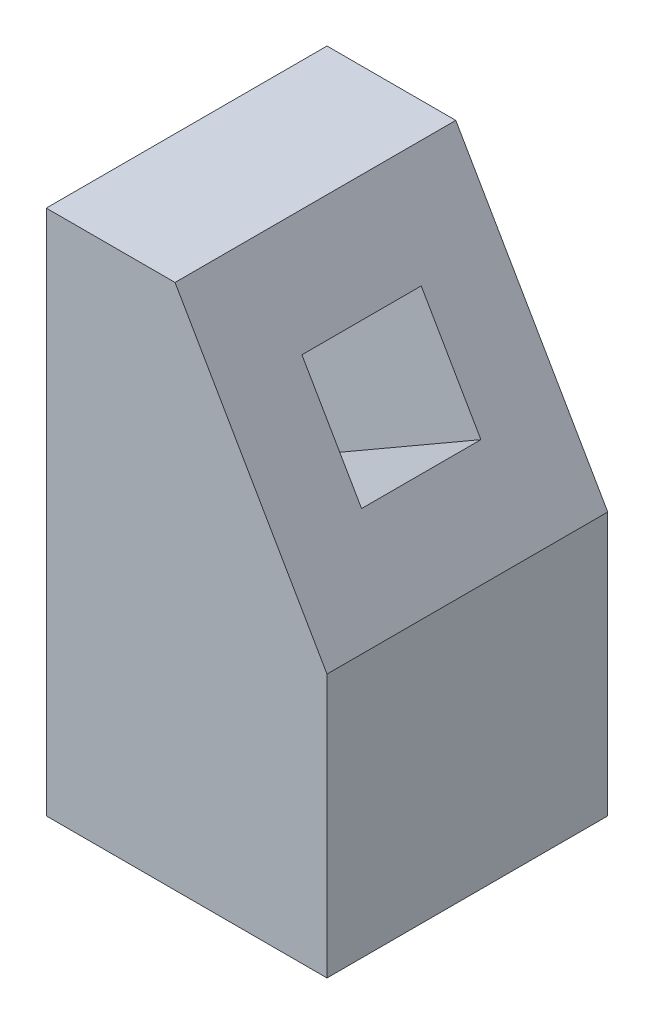
from build123d import *

# Parameters (mm, degrees)
SKETCH_1_W          = 8
SKETCH_1_H          = 8
EXTRUDE_1_DEPTH     = 15
CUT_EXTRUDE_1_REACH = 20.788
SKETCH_3_W          = 3.4
SKETCH_3_H          = 3.4
CUT_EXTRUDE_2_DEPTH = 10


with BuildPart() as part:
    # 草图1 → 凸台-拉伸1 (new body)
    with BuildSketch(Plane(origin=(0, 0, 0), x_dir=(1, 0, 0), z_dir=(0, 1, 0))):
        with Locations((4, 4)):
            Rectangle(SKETCH_1_W, SKETCH_1_H)
    extrude(amount=EXTRUDE_1_DEPTH)

    # 草图2 → 切除-拉伸1 (cut, up to next)
    with BuildSketch(Plane(origin=(0, 0, -8), x_dir=(-1, 0, 0), z_dir=(0, 0, -1)), mode=Mode.PRIVATE) as cut_extrude_1_sk1:
        Polygon((-8, 7.5), (-3.669872981, 15), (-8, 15), align=None)
    cut_extrude_1_tool1 = extrude(cut_extrude_1_sk1.sketch, amount=-CUT_EXTRUDE_1_REACH, mode=Mode.PRIVATE) & part.part
    add(cut_extrude_1_tool1.solids().sort_by_distance((6.556624, 12.5, -8))[0], mode=Mode.SUBTRACT)

    # 草图3 → 切除-拉伸2 (cut)
    with BuildSketch(Plane(origin=(9.247595264, 5.339101615, 0), x_dir=(0, 0, -1), z_dir=(0.8660254037844417, 0.4999999999999948, 0))):
        with Locations((4, 6.825317547)):
            Rectangle(SKETCH_3_W, SKETCH_3_H)
    extrude(amount=-CUT_EXTRUDE_2_DEPTH, mode=Mode.SUBTRACT)


solid = part.part
